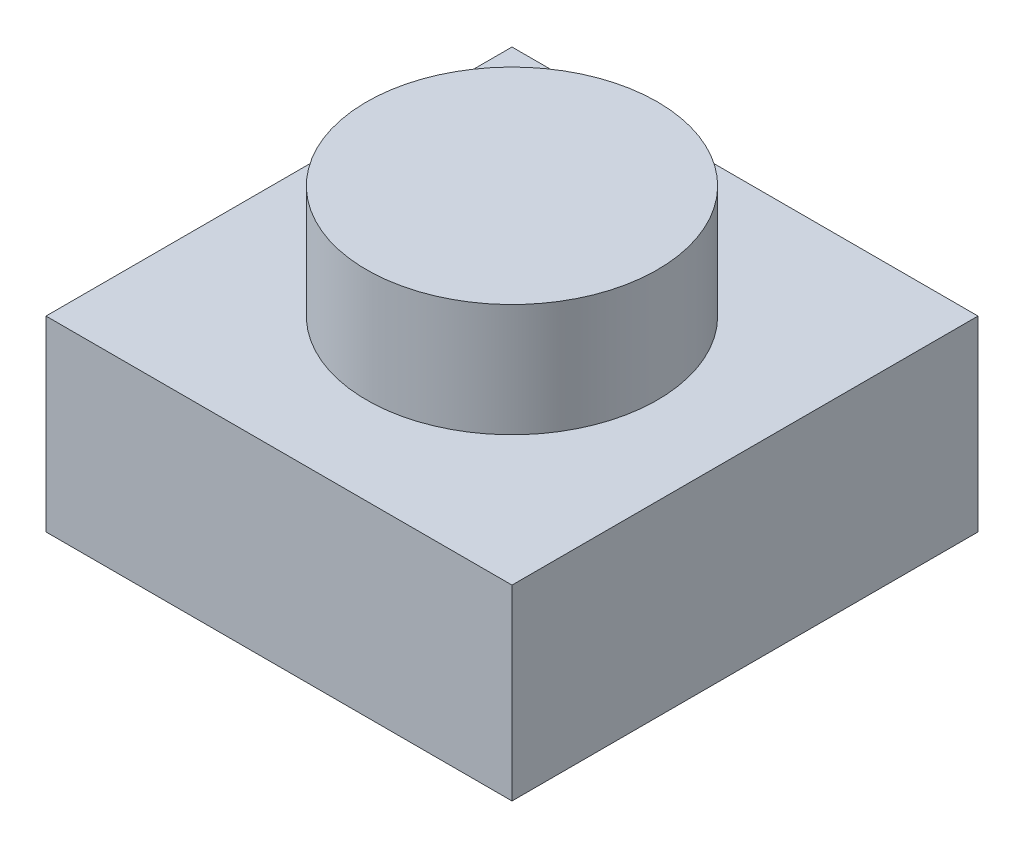
from build123d import *

# Parameters (mm, degrees)
SKETCH1_W           = 7.85
SKETCH1_H           = 7.85
BOSS_EXTRUDE1_DEPTH = 3.15
SKETCH2_R           = 2.45
BOSS_EXTRUDE2_DEPTH = 1.9
SHELL1_T            = -1.5


with BuildPart() as part:
    # Sketch1 → Boss-Extrude1 (new body)
    with BuildSketch(Plane(origin=(0, 0, 0), x_dir=(1, 0, 0), z_dir=(0, 1, 0))):
        Rectangle(SKETCH1_W, SKETCH1_H)
    extrude(amount=-BOSS_EXTRUDE1_DEPTH)

    # Sketch2 → Boss-Extrude2 (add)
    with BuildSketch(Plane(origin=(0, 0, 0), x_dir=(1, 0, 0), z_dir=(0, 1, 0))):
        with Locations(Location((0, 0, 0), (0, 0, 90))):
            Circle(SKETCH2_R)
    extrude(amount=BOSS_EXTRUDE2_DEPTH)

    # Shell1
    shell1_openings = [part.faces().sort_by_distance(p)[0] for p in [
        (0, -3.15, 0),
    ]]
    offset(amount=SHELL1_T, openings=shell1_openings, kind=Kind.INTERSECTION)


solid = part.part
